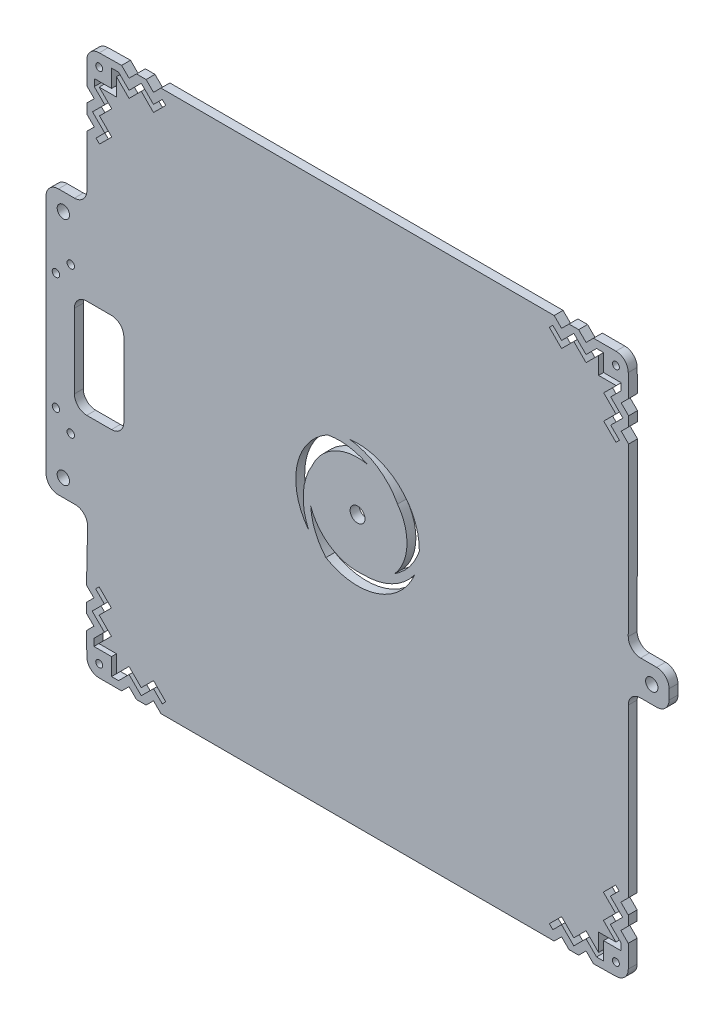
from build123d import *

# Parameters (mm, degrees)
MODEL_R             = 1.4
MODEL_R_2           = 2.5
MODEL_R_3           = 1.5
MODEL_R_4           = 3
BOSS_EXTRUDE1_DEPTH = 3.6


with BuildPart() as part:
    # Model → Boss-Extrude1 (new body)
    with BuildSketch(Plane.XY):
        with BuildLine():
            Line((2.5, 125.6), (-4, 125.6))
            ThreePointArc((-4, 125.6), (-7.535533906, 124.135533906), (-9, 120.6))
            Line((-9, 120.6), (-9, 23.4))
            ThreePointArc((-9, 23.4), (-7.535533906, 19.864466094), (-4, 18.4))
            Line((-4, 18.4), (2.812280928, 18.4))
            ThreePointArc((2.812280928, 18.4), (6.386080164, 16.896849871), (7.811096687, 13.291183609))
            Line((7.811096687, 13.291183609), (7.357864376, -7.529437252))
            Line((7.357864376, -7.529437252), (10.357864376, -10.529437252))
            Line((10.357864376, -10.529437252), (7.357864376, -13.529437252))
            Line((7.357864376, -13.529437252), (7.357864376, -17.428932188))
            Line((7.357864376, -17.428932188), (10.357864376, -20.428932188))
            Line((10.357864376, -20.428932188), (7.357864376, -23.428932188))
            Line((7.357864376, -23.428932188), (7.5, -32.5))
            ThreePointArc((7.5, -32.5), (8.964466094, -36.035533906), (12.5, -37.5))
            Line((12.5, -37.5), (21.571067812, -37.5))
            Line((21.571067812, -37.5), (24.571067812, -34.5))
            Line((24.571067812, -34.5), (27.571067812, -37.5))
            Line((27.571067812, -37.5), (31.470562748, -37.5))
            Line((31.470562748, -37.5), (34.470562748, -34.5))
            Line((34.470562748, -34.5), (37.470562748, -37.5))
            Line((37.470562748, -37.5), (196.529437252, -37.642135624))
            Line((196.529437252, -37.642135624), (199.529437252, -34.642135624))
            Line((199.529437252, -34.642135624), (202.529437252, -37.642135624))
            Line((202.529437252, -37.642135624), (206.428932188, -37.642135624))
            Line((206.428932188, -37.642135624), (209.428932188, -34.642135624))
            Line((209.428932188, -34.642135624), (212.428932188, -37.642135624))
            Line((212.428932188, -37.642135624), (221.5, -37.5))
            ThreePointArc((221.5, -37.5), (225.035533906, -36.035533906), (226.5, -32.5))
            Line((226.5, -32.5), (226.5, -23.428932188))
            Line((226.5, -23.428932188), (223.5, -20.428932188))
            Line((223.5, -20.428932188), (226.5, -17.428932188))
            Line((226.5, -17.428932188), (226.5, -13.529437252))
            Line((226.5, -13.529437252), (223.5, -10.529437252))
            Line((223.5, -10.529437252), (226.5, -7.529437252))
            Line((226.5, -7.529437252), (226.5, 60))
            ThreePointArc((226.5, 60), (227.964466094, 63.535533906), (231.5, 65))
            Line((231.5, 65), (238, 65))
            ThreePointArc((238, 65), (241.535533906, 66.464466094), (243, 70))
            Line((243, 70), (243, 74))
            ThreePointArc((243, 74), (241.535533906, 77.535533906), (238, 79))
            Line((238, 79), (231.493404186, 79))
            ThreePointArc((231.493404186, 79), (227.953978663, 80.468361999), (226.493416315, 84.011013212))
            Line((226.493416315, 84.011013212), (226.642135624, 151.529437252))
            Line((226.642135624, 151.529437252), (223.642135624, 154.529437252))
            Line((223.642135624, 154.529437252), (226.642135624, 157.529437252))
            Line((226.642135624, 157.529437252), (226.642135624, 161.428932188))
            Line((226.642135624, 161.428932188), (223.642135624, 164.428932188))
            Line((223.642135624, 164.428932188), (226.642135624, 167.428932188))
            Line((226.642135624, 167.428932188), (226.5, 176.5))
            ThreePointArc((226.5, 176.5), (225.035533906, 180.035533906), (221.5, 181.5))
            Line((221.5, 181.5), (212.428932188, 181.5))
            Line((212.428932188, 181.5), (209.428932188, 178.5))
            Line((209.428932188, 178.5), (206.428932188, 181.5))
            Line((206.428932188, 181.5), (202.529437252, 181.5))
            Line((202.529437252, 181.5), (199.529437252, 178.5))
            Line((199.529437252, 178.5), (196.529437252, 181.5))
            Line((196.529437252, 181.5), (37.470562748, 181.642135624))
            Line((37.470562748, 181.642135624), (34.470562748, 178.642135624))
            Line((34.470562748, 178.642135624), (31.470562748, 181.642135624))
            Line((31.470562748, 181.642135624), (27.571067812, 181.642135624))
            Line((27.571067812, 181.642135624), (24.571067812, 178.642135624))
            Line((24.571067812, 178.642135624), (21.571067812, 181.642135624))
            Line((21.571067812, 181.642135624), (12.5, 181.5))
            ThreePointArc((12.5, 181.5), (8.964466094, 180.035533906), (7.5, 176.5))
            Line((7.5, 176.5), (7.5, 167.428932188))
            Line((7.5, 167.428932188), (10.5, 164.428932188))
            Line((10.5, 164.428932188), (7.5, 161.428932188))
            Line((7.5, 161.428932188), (7.5, 157.529437252))
            Line((7.5, 157.529437252), (10.5, 154.529437252))
            Line((10.5, 154.529437252), (7.5, 151.529437252))
            Line((7.5, 151.529437252), (7.5, 130.6))
            ThreePointArc((7.5, 130.6), (6.035533906, 127.064466094), (2.5, 125.6))
        make_face()
        with Locations((12.5, -32.5)):
            Circle(MODEL_R, mode=Mode.SUBTRACT)
        Polygon((38.006096654, -33.792893219), (34.470562748, -30.257359313), (29.52081528, -35.207106781), (24.571067812, -30.257359313), (20.328427125, -34.5), (17.5, -34.5), (17.5, -27.5), (10.357864376, -27.5), (10.357864376, -24.671572875), (14.600505063, -20.428932188), (9.650757595, -15.47918472), (14.600505063, -10.529437252), (11.064971157, -6.993903346), (12.47918472, -5.579689783), (17.428932188, -10.529437252), (12.47918472, -15.47918472), (17.428932188, -20.428932188), (12.357864376, -25.5), (19.5, -25.5), (19.5, -32.5), (24.571067812, -27.428932188), (29.52081528, -32.378679656), (34.470562748, -27.428932188), (39.420310217, -32.378679656), align=None, mode=Mode.SUBTRACT)
        with Locations((-2, 25.4)):
            Circle(MODEL_R_2, mode=Mode.SUBTRACT)
        with Locations((1, 42.4)):
            Circle(MODEL_R_3, mode=Mode.SUBTRACT)
        with Locations((-5, 48.4)):
            Circle(MODEL_R_3, mode=Mode.SUBTRACT)
        with BuildLine():
            ThreePointArc((22.45836944, 57), (20.993903346, 53.464466094), (17.45836944, 52))
            Line((17.45836944, 52), (7.45836944, 52))
            ThreePointArc((7.45836944, 52), (3.922835534, 53.464466094), (2.45836944, 57))
            Line((2.45836944, 57), (2.45836944, 87))
            ThreePointArc((2.45836944, 87), (3.922835534, 90.535533906), (7.45836944, 92))
            Line((7.45836944, 92), (17.45836944, 92))
            ThreePointArc((17.45836944, 92), (20.993903346, 90.535533906), (22.45836944, 87))
            Line((22.45836944, 87), (22.45836944, 57))
        make_face(mode=Mode.SUBTRACT)
        Polygon((222.792893219, -6.993903346), (219.257359313, -10.529437252), (224.207106781, -15.47918472), (219.257359313, -20.428932188), (223.5, -24.671572875), (223.5, -27.5), (216.5, -27.5), (216.5, -34.642135624), (213.671572875, -34.642135624), (209.428932188, -30.399494937), (204.47918472, -35.349242405), (199.529437252, -30.399494937), (195.993903346, -33.935028843), (194.579689783, -32.52081528), (199.529437252, -27.571067812), (204.47918472, -32.52081528), (209.428932188, -27.571067812), (214.5, -32.642135624), (214.5, -25.5), (221.5, -25.5), (216.428932188, -20.428932188), (221.378679656, -15.47918472), (216.428932188, -10.529437252), (221.378679656, -5.579689783), align=None, mode=Mode.SUBTRACT)
        with Locations((221.5, -32.5)):
            Circle(MODEL_R, mode=Mode.SUBTRACT)
        with BuildLine():
            ThreePointArc((104.19185207, 50.530222484), (99.846369949, 57.570821061), (98.036793538, 65.644152246))
            ThreePointArc((98.036793538, 65.644152246), (106.183126883, 55.177537161), (119.086525733, 52.109137516))
            ThreePointArc((119.086525733, 52.109137516), (130.899528611, 54.682270439), (140.123742935, 62.497762754))
            ThreePointArc((140.123742935, 62.497762754), (124.899897474, 48.28098611), (104.19185207, 50.530222484))
        make_face(mode=Mode.SUBTRACT)
        with Locations((-5, 95.6)):
            Circle(MODEL_R_3, mode=Mode.SUBTRACT)
        with Locations((1, 101.6)):
            Circle(MODEL_R_3, mode=Mode.SUBTRACT)
        with Locations((-2, 118.6)):
            Circle(MODEL_R_2, mode=Mode.SUBTRACT)
        with BuildLine():
            ThreePointArc((120.977277613, 91.600542411), (107.839756386, 89.778918329), (98.730744919, 80.138446951))
            ThreePointArc((98.730744919, 80.138446951), (95.052641959, 68.621519903), (97.208949685, 56.725369811))
            ThreePointArc((97.208949685, 56.725369811), (92.508782682, 77.017995045), (104.810701222, 93.827070241))
            ThreePointArc((104.810701222, 93.827070241), (113.080779509, 94.070068861), (120.977277613, 91.600542411))
        make_face(mode=Mode.SUBTRACT)
        with Locations((117, 72)):
            Circle(MODEL_R_4, mode=Mode.SUBTRACT)
        with Locations((12.5, 176.5)):
            Circle(MODEL_R, mode=Mode.SUBTRACT)
        Polygon((11.207106781, 150.993903346), (14.742640687, 154.529437252), (9.792893219, 159.47918472), (14.742640687, 164.428932188), (10.5, 168.671572875), (10.5, 171.5), (17.5, 171.5), (17.5, 178.642135624), (20.328427125, 178.642135624), (24.571067812, 174.399494937), (29.52081528, 179.349242405), (34.470562748, 174.399494937), (38.006096654, 177.935028843), (39.420310217, 176.52081528), (34.470562748, 171.571067812), (29.52081528, 176.52081528), (24.571067812, 171.571067812), (19.5, 176.642135624), (19.5, 169.5), (12.5, 169.5), (17.571067812, 164.428932188), (12.621320344, 159.47918472), (17.571067812, 154.529437252), (12.621320344, 149.579689783), align=None, mode=Mode.SUBTRACT)
        with BuildLine():
            ThreePointArc((141.997446708, 71.642707275), (138.072850542, 64.359110078), (131.985928849, 58.755305344))
            ThreePointArc((131.985928849, 58.755305344), (136.977116731, 71.04354451), (133.182729348, 83.752415533))
            ThreePointArc((133.182729348, 83.752415533), (125.04782943, 92.696209658), (113.66730738, 96.776867435))
            ThreePointArc((113.66730738, 96.776867435), (133.591319844, 90.701018845), (141.997446708, 71.642707275))
        make_face(mode=Mode.SUBTRACT)
        with Locations((236, 72)):
            Circle(MODEL_R_2, mode=Mode.SUBTRACT)
        Polygon((195.993903346, 177.792893219), (199.529437252, 174.257359313), (204.47918472, 179.207106781), (209.428932188, 174.257359313), (213.671572875, 178.5), (216.5, 178.5), (216.5, 171.5), (223.642135624, 171.5), (223.642135624, 168.671572875), (219.399494937, 164.428932188), (224.349242405, 159.47918472), (219.399494937, 154.529437252), (222.935028843, 150.993903346), (221.52081528, 149.579689783), (216.571067812, 154.529437252), (221.52081528, 159.47918472), (216.571067812, 164.428932188), (221.642135624, 169.5), (214.5, 169.5), (214.5, 176.5), (209.428932188, 171.428932188), (204.47918472, 176.378679656), (199.529437252, 171.428932188), (194.579689783, 176.378679656), align=None, mode=Mode.SUBTRACT)
        with Locations((221.5, 176.5)):
            Circle(MODEL_R, mode=Mode.SUBTRACT)
    extrude(amount=BOSS_EXTRUDE1_DEPTH)


solid = part.part
